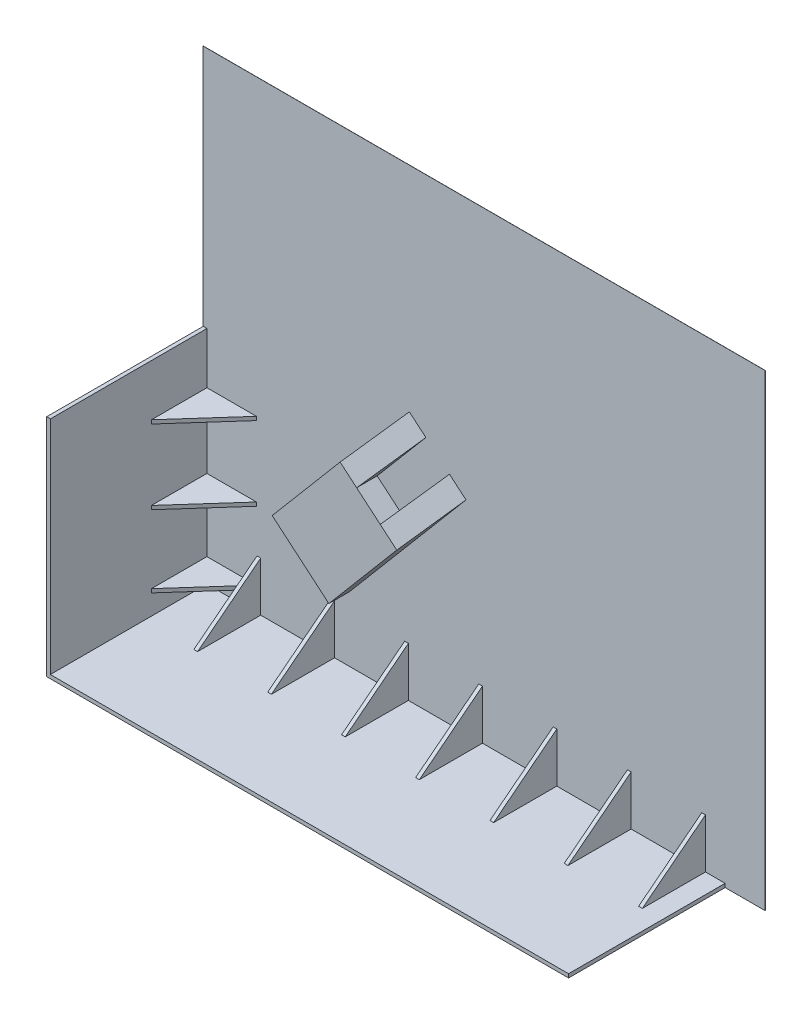
from build123d import *

# Parameters (mm, degrees)
BOSS_EXTRUDE1_DEPTH = 1266
BOSS_EXTRUDE2_DEPTH = 2500
BOSS_EXTRUDE3_DEPTH = 902.5
CUT_EXTRUDE1_DEPTH  = 3630
CUT_EXTRUDE3_DEPTH  = 1220
SKETCH8_W           = 485
SKETCH8_H           = 285
CUT_EXTRUDE5_DEPTH  = 390
SKETCH9_W           = 270
SKETCH9_H           = 285
CUT_EXTRUDE6_DEPTH  = 390
SKETCH10_W          = 470
SKETCH10_H          = 285
CUT_EXTRUDE7_DEPTH  = 390
SKETCH11_W          = 485
SKETCH11_H          = 217.5
CUT_EXTRUDE8_DEPTH  = 390
SKETCH12_W          = 270
SKETCH12_H          = 217.5
CUT_EXTRUDE9_DEPTH  = 390
SKETCH13_W          = 470
SKETCH13_H          = 217.5
CUT_EXTRUDE10_DEPTH = 390
SKETCH14_W          = 585
SKETCH14_H          = 155.831493033
CUT_EXTRUDE11_DEPTH = 499
SKETCH15_W          = 6996.313715464
SKETCH15_H          = 5079.044050363
BOSS_EXTRUDE5_DEPTH = 1
BOSS_EXTRUDE8_DEPTH = 166
CUT_EXTRUDE12_DEPTH = 180
CUT_EXTRUDE13_DEPTH = 180
SKETCH25_W          = 2533.673727512
SKETCH25_H          = 5079.044050363
CUT_EXTRUDE14_DEPTH = 20000
SKETCH26_W          = 6996.313715464
SKETCH26_H          = 1296.619269855
CUT_EXTRUDE15_DEPTH = 2000
SKETCH27_W          = 2452.172937996
SKETCH27_H          = 3782.424780508
CUT_EXTRUDE16_DEPTH = 2000


with BuildPart() as part:
    # walls → Boss-Extrude1 (new body)
    with BuildSketch(Plane.XY):
        Polygon((0, 0), (4220, 0), (4220, 30), (4061, 30), (4061, 430), (4031, 430), (4031, 30), (3460, 30), (3460, 430), (3430, 430), (3430, 30), (2859, 30), (2859, 430), (2829, 430), (2829, 30), (2258, 30), (2258, 430), (2228, 430), (2228, 30), (1659, 30), (1659, 430), (1629, 430), (1629, 30), (1062, 30), (1062, 430), (1032, 430), (1032, 30), (465, 30), (465, 430), (435, 430), (435, 30), (30, 30), (30, 192.5), (430, 192.5), (430, 222.5), (30, 222.5), (30, 775), (430, 775), (430, 805), (30, 805), (30, 1375), (430, 1375), (430, 1405), (30, 1405), (30, 1820), (0, 1820), (0, 30), align=None)
    extrude(amount=BOSS_EXTRUDE1_DEPTH)

    # large_wall_cut → Cut-Extrude1 (cut)
    with BuildSketch(Plane(origin=(4061, 0, 0), x_dir=(0, 0, -1), z_dir=(1, 0, 0))):
        Polygon((-1266, 30), (-1266, 430), (0, 430), (-510.635057002, 30), align=None)
    extrude(amount=-CUT_EXTRUDE1_DEPTH, mode=Mode.SUBTRACT)

    # small_wall_cut → Cut-Extrude3 (cut)
    with BuildSketch(Plane(origin=(0, 1405, 0), x_dir=(1, 0, 0), z_dir=(0, 1, 0))):
        Polygon((30, -1266), (430, -1266), (430, 0), (30, -448.280892995), align=None)
    extrude(amount=-CUT_EXTRUDE3_DEPTH, mode=Mode.SUBTRACT)



with BuildPart() as body_2:
    # column → Boss-Extrude2 (new body)
    with BuildSketch(Plane(origin=(914.708707022, 1935.068858389, 0), x_dir=(1, 0, 0), z_dir=(0, 0, 1))):
        Polygon((5085, 2493.425486023), (5585, 2493.425486023), (5585, 1993.425486023), (5285, 1993.425486023), (5285, 2193.425486023), (5085, 2193.425486023), align=None)
    extrude(amount=BOSS_EXTRUDE2_DEPTH)


with BuildPart() as body_3:
    # stairs → Boss-Extrude3 (new body)
    with BuildSketch(Plane(origin=(5389.144664379, -90.533957801, 0), x_dir=(1, 0, 0), z_dir=(0, 0, 1))):
        Polygon((0, 2425), (1250, 2425), (1250, 2721), (814.684080579, 2721), (814.684080579, 2766), (1295, 2766), (1295, 2721), (1295, 2425), (1295, 2380), (0, 2380), align=None)
    extrude(amount=BOSS_EXTRUDE3_DEPTH)

    # Sketch8 → Cut-Extrude5 (cut)
    with BuildSketch(Plane(origin=(5389.144664379, 2289.466042199, 0), x_dir=(-1, 0, 0), z_dir=(0, -1, 0))):
        with Locations((-242.5, -142.5)):
            Rectangle(SKETCH8_W, SKETCH8_H)
    extrude(amount=-CUT_EXTRUDE5_DEPTH, mode=Mode.SUBTRACT)

    # Sketch9 → Cut-Extrude6 (cut)
    with BuildSketch(Plane(origin=(5389.144664379, 2289.466042199, 0), x_dir=(1, 0, 0), z_dir=(0, -1, 0))):
        with Locations((655, 142.5)):
            Rectangle(SKETCH9_W, SKETCH9_H)
    extrude(amount=-CUT_EXTRUDE6_DEPTH, mode=Mode.SUBTRACT)

    # Sketch10 → Cut-Extrude7 (cut)
    with BuildSketch(Plane(origin=(5389.144664379, 2289.466042199, 0), x_dir=(1, 0, 0), z_dir=(0, -1, 0))):
        with Locations((1060, 142.5)):
            Rectangle(SKETCH10_W, SKETCH10_H)
    extrude(amount=-CUT_EXTRUDE7_DEPTH, mode=Mode.SUBTRACT)

    # Sketch11 → Cut-Extrude8 (cut)
    with BuildSketch(Plane(origin=(5389.144664379, 2289.466042199, 0), x_dir=(-1, 0, 0), z_dir=(0, -1, 0))):
        with Locations((-242.5, -743.75)):
            Rectangle(SKETCH11_W, SKETCH11_H)
    extrude(amount=-CUT_EXTRUDE8_DEPTH, mode=Mode.SUBTRACT)

    # Sketch12 → Cut-Extrude9 (cut)
    with BuildSketch(Plane(origin=(5389.144664379, 2289.466042199, 0), x_dir=(1, 0, 0), z_dir=(0, -1, 0))):
        with Locations((655, 743.75)):
            Rectangle(SKETCH12_W, SKETCH12_H)
    extrude(amount=-CUT_EXTRUDE9_DEPTH, mode=Mode.SUBTRACT)

    # Sketch13 → Cut-Extrude10 (cut)
    with BuildSketch(Plane(origin=(5389.144664379, 2289.466042199, 0), x_dir=(1, 0, 0), z_dir=(0, -1, 0))):
        with Locations((1060, 743.75)):
            Rectangle(SKETCH13_W, SKETCH13_H)
    extrude(amount=-CUT_EXTRUDE10_DEPTH, mode=Mode.SUBTRACT)

    # Sketch14 → Cut-Extrude11 (cut)
    with BuildSketch(Plane(origin=(6684.144664379, -90.533957801, 0), x_dir=(0, 0, -1), z_dir=(1, 0, 0))):
        with Locations((-292.5, 2688.084253484)):
            Rectangle(SKETCH14_W, SKETCH14_H)
    extrude(amount=-CUT_EXTRUDE11_DEPTH, mode=Mode.SUBTRACT)


with BuildPart() as part_1:
    add(part.part)

    add(body_2.part)  # Boss-Extrude5 merges body 2

    add(body_3.part)  # Boss-Extrude5 merges body 3
    # Sketch15 → Boss-Extrude5 (add)
    with BuildSketch(Plane(origin=(0, 0, 0), x_dir=(-1, 0, 0), z_dir=(0, 0, -1))):
        with Locations((-3498.156857732, 2539.522025182)):
            Rectangle(SKETCH15_W, SKETCH15_H)
    extrude(amount=BOSS_EXTRUDE5_DEPTH)

    # Sketch18 → Boss-Extrude8 (add)
    with BuildSketch(Plane(origin=(-186.04659113, 70.659630185, 0), x_dir=(0.968147640378129, 0.2503800040543594, 0), z_dir=(0, 0, 1))):
        Polygon((1445.048616126, 124.013590319), (2138.990862123, 614.874221478), (2636.996473956, 967.138909721), (2535.936932247, 1110.009372132), (2037.931320414, 757.744683889), (1893.560546544, 961.845344476), (2391.566158377, 1314.110032719), (2290.506616668, 1456.98049513), (1792.501004835, 1104.715806887), (1098.558758838, 613.855175729), align=None)
    extrude(amount=BOSS_EXTRUDE8_DEPTH)

    # Sketch20 → Cut-Extrude12 (cut)
    with BuildSketch(Plane(origin=(424.631523371, -71.78750701, 0), x_dir=(0.645808072001047, 0.7634997931488198, 0), z_dir=(-0.7634997931488198, 0.645808072001047, 0))):
        Polygon((2425.734764591, 0), (1815.734764591, -166), (2425.734764591, -166), align=None)
    extrude(amount=-CUT_EXTRUDE12_DEPTH, mode=Mode.SUBTRACT)

    # Sketch21 → Cut-Extrude13 (cut)
    with BuildSketch(Plane(origin=(233.756575084, 89.664510991, 0), x_dir=(-0.6458080720010444, -0.7634997931488219, 0), z_dir=(0.7634997931488219, -0.6458080720010444, 0))):
        Polygon((-2425.734764591, 0), (-1815.734764591, -166), (-2425.734764591, -166), align=None)
    extrude(amount=-CUT_EXTRUDE13_DEPTH, mode=Mode.SUBTRACT)

    # Sketch25 → Cut-Extrude14 (cut)
    with BuildSketch(Plane.XY):
        with Locations((5729.476851708, 2539.522025182)):
            Rectangle(SKETCH25_W, SKETCH25_H)
    extrude(amount=CUT_EXTRUDE14_DEPTH, mode=Mode.SUBTRACT)

    # Sketch26 → Cut-Extrude15 (cut)
    with BuildSketch(Plane.XY):
        with Locations((3498.156857732, 4430.734415436)):
            Rectangle(SKETCH26_W, SKETCH26_H)
    extrude(amount=-CUT_EXTRUDE15_DEPTH, mode=Mode.SUBTRACT)

    # Sketch27 → Cut-Extrude16 (cut)
    with BuildSketch(Plane.XY):
        with Locations((5770.227246466, 1891.212390254)):
            Rectangle(SKETCH27_W, SKETCH27_H)
    extrude(amount=-CUT_EXTRUDE16_DEPTH, mode=Mode.SUBTRACT)


solid = part_1.part
